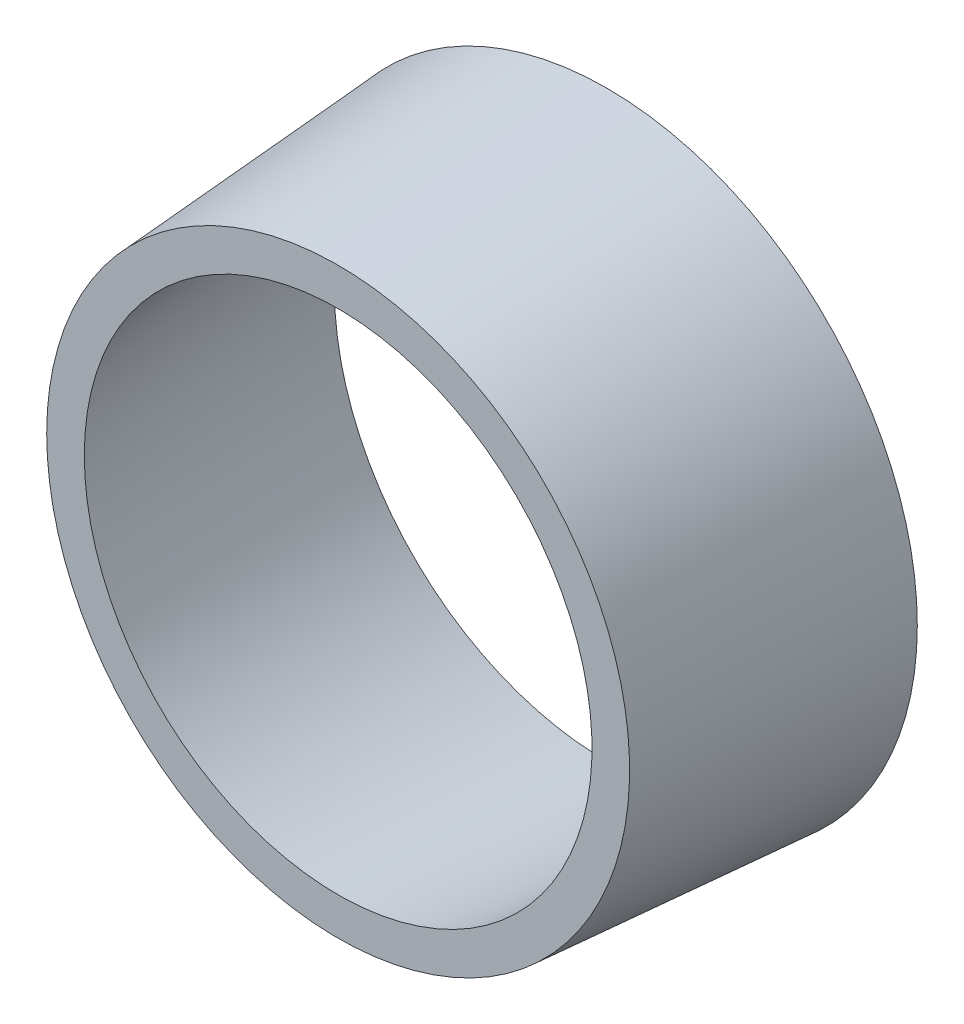
from build123d import *


with BuildPart() as part:
    # Sketch1 → Revolve1 (revolve)
    with BuildSketch(Plane.YZ, mode=Mode.PRIVATE) as revolve1_sk:
        Polygon((18.415, 0), (20.955, 0), (19.685, 18.161846146), (17.145, 18.161846146), align=None)
    revolve(revolve1_sk.sketch.rotate(Axis((0, 0, 0), (0, 0, 1)), 90), axis=Axis((0, 0, 0), (0, 0, 1)))


solid = part.part
